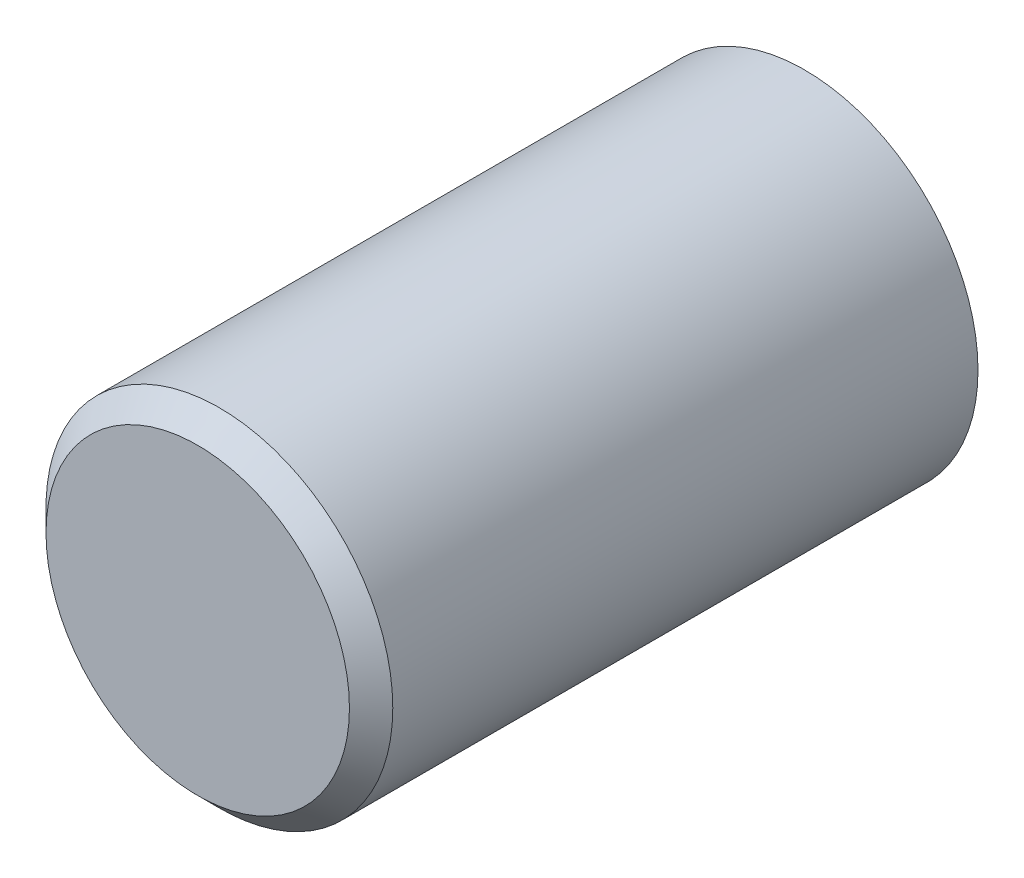
from build123d import *

# Parameters (mm, degrees)
ESQUISSE1_R           = 4
BOSS_EXTRU_1_DEPTH    = 14
CHANFREIN1_SIZE       = 0.5
TROU_TARAUD_M41_D     = 3.3
TROU_TARAUD_M41_DEPTH = 11.5
TROU_TARAUD_M41_TIP   = 0.991420021


with BuildPart() as part:
    # Esquisse1 → Boss.-Extru.1 (new body)
    with BuildSketch(Plane.XY):
        Circle(ESQUISSE1_R)
    extrude(amount=BOSS_EXTRU_1_DEPTH)

    # Chanfrein1
    chanfrein1_edges = [part.edges().sort_by_distance(p)[0] for p in [
        (-4, 0, 14),
    ]]
    chamfer(chanfrein1_edges, length=CHANFREIN1_SIZE)

    # Trou taraudé M41
    with Locations(Plane(origin=(0, 0, 0), x_dir=(-1, 0, 0), z_dir=(0, 0, -1))):
        with Locations((0, 0)):
            Hole(TROU_TARAUD_M41_D / 2, depth=TROU_TARAUD_M41_DEPTH)
            with Locations((0, 0, -(TROU_TARAUD_M41_DEPTH + TROU_TARAUD_M41_TIP / 2))):  # 118° drill point
                Cone(0, TROU_TARAUD_M41_D / 2, TROU_TARAUD_M41_TIP, mode=Mode.SUBTRACT)


solid = part.part
